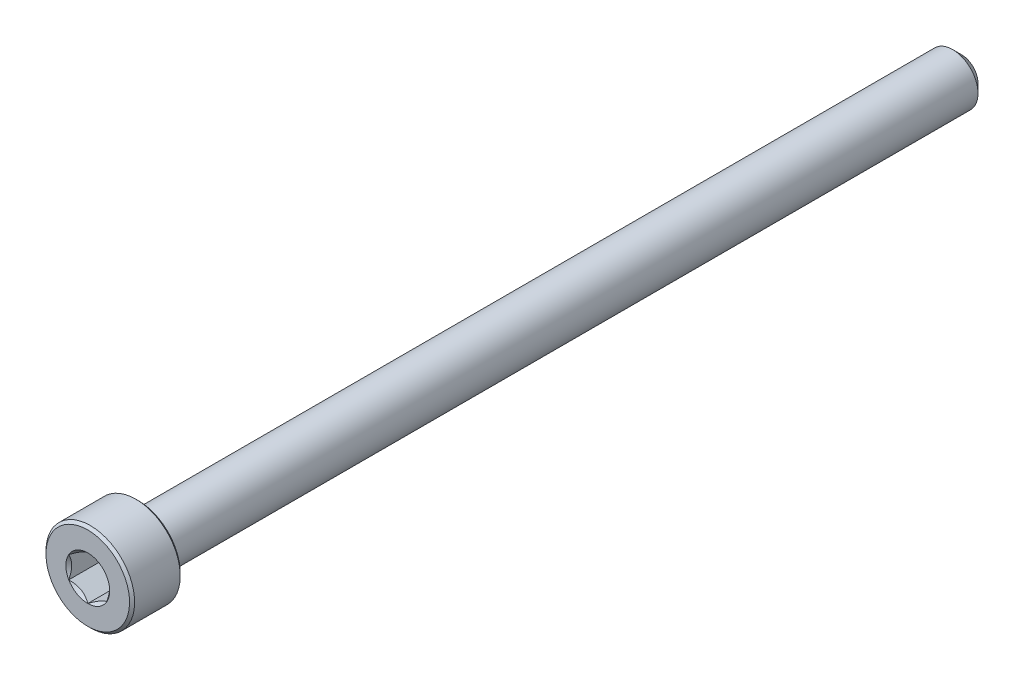
from build123d import *

# Parameters (mm, degrees)
CUT_EXTRUDE1_DEPTH = 3


with BuildPart() as part:
    # Sketch2 → Revolve1 (revolve)
    with BuildSketch(Plane(origin=(0, 0, 0), x_dir=(0, 0, -1), z_dir=(1, 0, 0))):
        Polygon((-34.5, 0), (-34.5, 3.3), (-34.3, 3.5), (-30.7, 3.5), (-30.5, 3.3), (-30.5, 2), (33.8, 2), (34.5, 1.3), (34.5, 0), align=None)
    revolve(axis=Axis((0, 0, -34.5), (0, 0, 1)))

    # Sketch3 → Cut-Extrude1 (cut)
    with BuildSketch(Plane.XY.offset(34.5)):
        Polygon((1.5, -0.866025404), (1.5, 0.866025404), (0, 1.732050808), (-1.5, 0.866025404), (-1.5, -0.866025404), (0, -1.732050808), align=None)
    extrude(amount=-CUT_EXTRUDE1_DEPTH, mode=Mode.SUBTRACT)

    # Cut-Extrude2 cone 1 section (through the dimple's axis) → Cut-Extrude2 (revolve, cut)
    with BuildSketch(Plane(origin=(0, 0, 34.5), x_dir=(0, -1, 0), z_dir=(1, 0, 0))):
        Polygon((0, 0), (1.732050808, 0), (0, 1.732050808), align=None)
    revolve(axis=Axis((0, 0, 34.5), (0, 0, -1)), mode=Mode.SUBTRACT)


solid = part.part
